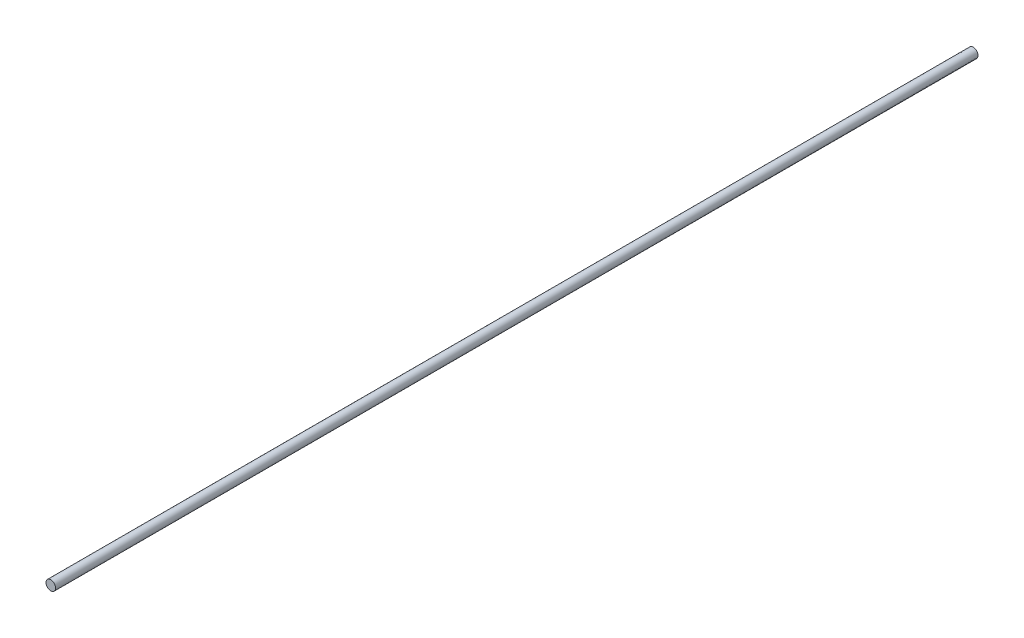
from build123d import *

# Parameters (mm, degrees)
SKETCH1_R           = 3.175
BOSS_EXTRUDE1_DEPTH = 609.6


with BuildPart() as part:
    # Sketch1 → Boss-Extrude1 (new body)
    with BuildSketch(Plane.XY):
        with Locations(Location((0, 0, 0), (0, 0, 180))):
            Circle(SKETCH1_R)
    extrude(amount=BOSS_EXTRUDE1_DEPTH)


solid = part.part
